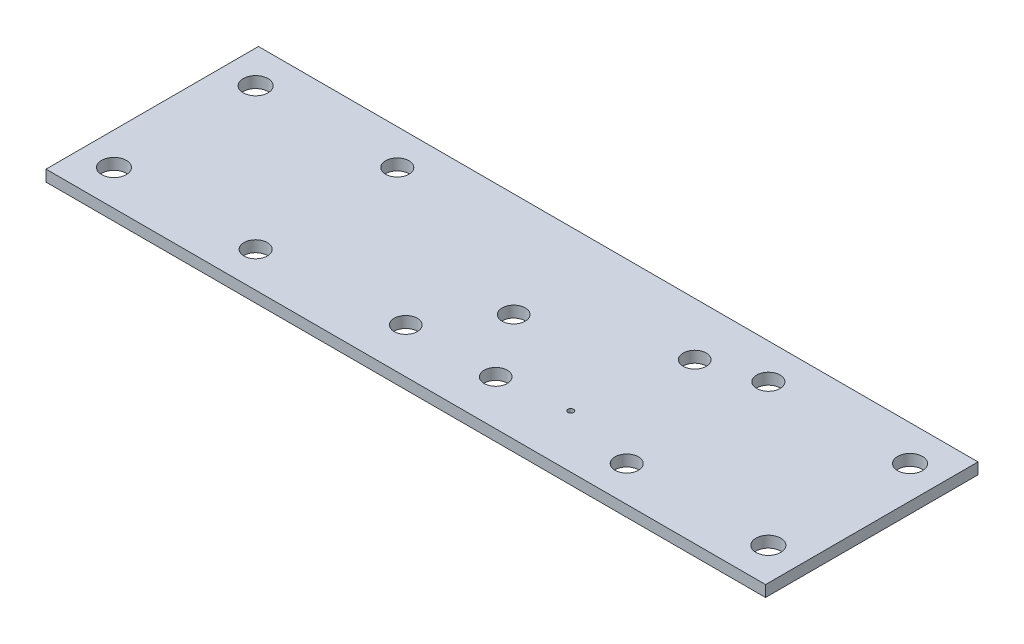
from build123d import *

# Parameters (mm, degrees)
SKETCH1_W                      = 203.2
SKETCH1_H                      = 60
SKETCH1_R                      = 3.3
SKETCH1_R_2                    = 3.5
BOSS_EXTRUDE1_DEPTH            = 3.175
SKETCH2_R                      = 3.2639
F_1_4_20_FOR_NUT_BRACKET_DEPTH = 106.984152707
SKETCH3_R                      = 0.79375
SKETCH3_R_2                    = 3.2639
WIRE_HOLDER_DEPTH              = 106.984152707


with BuildPart() as part:
    # Sketch1 → Boss-Extrude1 (new body)
    with BuildSketch(Plane(origin=(0, 0, 0), x_dir=(1, 0, 0), z_dir=(0, 1, 0))):
        Rectangle(SKETCH1_W, SKETCH1_H)
        with Locations(Location((-52.4, 20, 0), (0, 0, 270))):
            Circle(SKETCH1_R, mode=Mode.SUBTRACT)
        with Locations(Location((-92.4, -20, 0), (0, 0, 90))):
            Circle(SKETCH1_R_2, mode=Mode.SUBTRACT)
        with Locations(Location((-52.4, -20, 0), (0, 0, 90))):
            Circle(SKETCH1_R, mode=Mode.SUBTRACT)
        with Locations(Location((92.4, 20, 0), (0, 0, 90))):
            Circle(SKETCH1_R_2, mode=Mode.SUBTRACT)
        with Locations(Location((-92.4, 20, 0), (0, 0, 270))):
            Circle(SKETCH1_R_2, mode=Mode.SUBTRACT)
        with Locations(Location((52.4, -20, 0), (0, 0, 270))):
            Circle(SKETCH1_R, mode=Mode.SUBTRACT)
        with Locations(Location((92.4, -20, 0), (0, 0, 270))):
            Circle(SKETCH1_R_2, mode=Mode.SUBTRACT)
        with Locations(Location((52.4, 20, 0), (0, 0, 90))):
            Circle(SKETCH1_R, mode=Mode.SUBTRACT)
    extrude(amount=BOSS_EXTRUDE1_DEPTH)

    # Sketch2 → 1/4-20 for Nut Bracket (cut, through all)
    with BuildSketch(Plane(origin=(0, 3.175, 0), x_dir=(1, 0, 0), z_dir=(0, 1, 0))):
        with Locations(Location((-12.7, -17.3, 0), (0, 0, 270))):
            Circle(SKETCH2_R)
        with Locations(Location((12.7, -17.3, 0), (0, 0, 270))):
            Circle(SKETCH2_R)
        with Locations(Location((0, 0.48, 0), (0, 0, 270))):
            Circle(SKETCH2_R)
    extrude(amount=-F_1_4_20_FOR_NUT_BRACKET_DEPTH, mode=Mode.SUBTRACT)

    # Sketch3 → Wire Holder (cut, through all)
    with BuildSketch(Plane(origin=(0, 3.175, 0), x_dir=(1, 0, 0), z_dir=(0, 1, 0))):
        with Locations(Location((31.6, -15, 0), (0, 0, 270))):
            Circle(SKETCH3_R)
        with Locations(Location((36.6, 15, 0), (0, 0, 270))):
            Circle(SKETCH3_R_2)
    extrude(amount=-WIRE_HOLDER_DEPTH, mode=Mode.SUBTRACT)


solid = part.part
